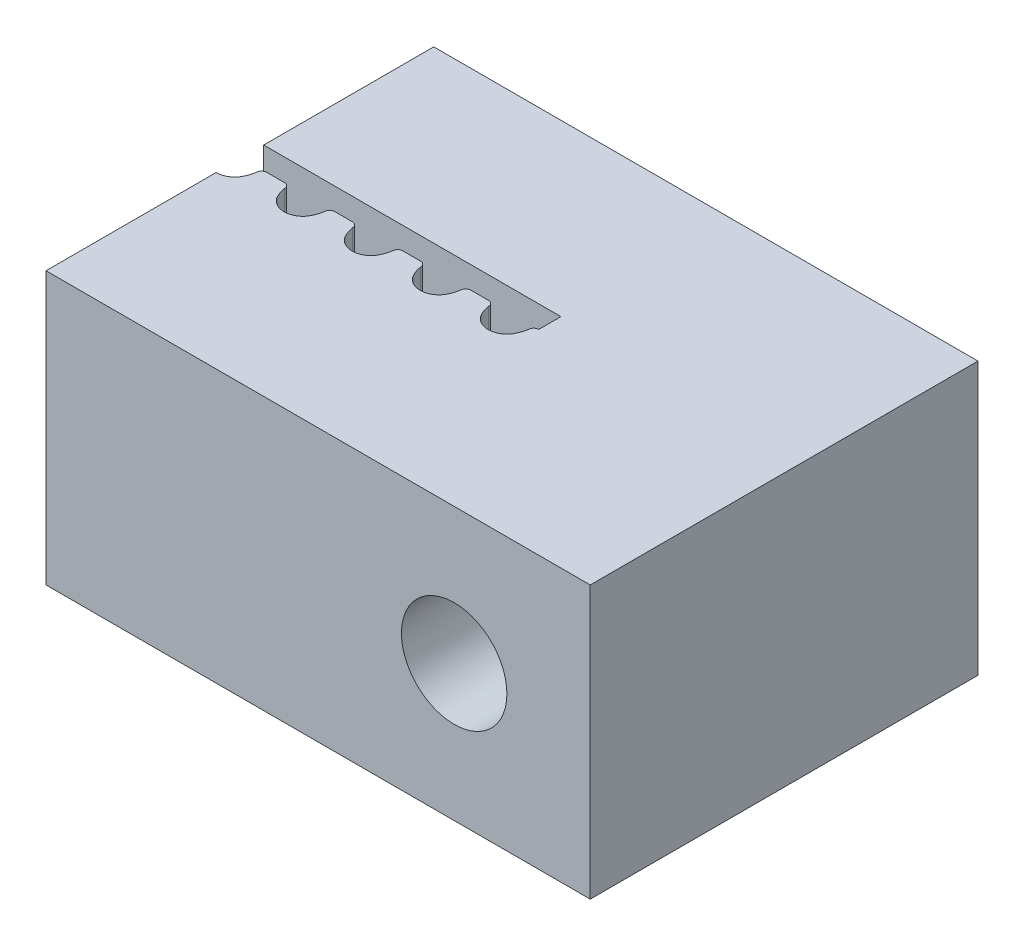
from build123d import *

# Parameters (mm, degrees)
BOSS_EXTRUDE1_DEPTH = 8
SKETCH3_W           = 7
SKETCH3_H           = 0.75
BOSS_EXTRUDE2_DEPTH = 8
BOSS_EXTRUDE3_DEPTH = 8
CUT_EXTRUDE1_REACH  = 21.747
SKETCH2_R           = 1.55


with BuildPart() as part:
    # Sketch1 → Boss-Extrude1 (new body)
    with BuildSketch(Plane(origin=(0, 0, 0), x_dir=(1, 0, 0), z_dir=(0, 1, 0))):
        with BuildLine():
            Line((-0.73791447, 0.195), (-1.26208553, 0.195))
            ThreePointArc((-1.26208553, 0.195), (-1.368151547, 0.151066017), (-1.41208553, 0.045))
            ThreePointArc((-1.41208553, 0.045), (-1.459490829, -0.139768303), (-1.541118048, -0.312173597))
            ThreePointArc((-1.541118048, -0.312173597), (-1.740415087, -0.490551397), (-2, -0.555))
            Line((-2, -0.555), (-2, -5.555))
            Line((-2, -5.555), (14, -5.555))
            Line((14, -5.555), (14, -0.555))
            ThreePointArc((14, -0.555), (13.740415087, -0.490551397), (13.541118048, -0.312173597))
            ThreePointArc((13.541118048, -0.312173597), (13.459490829, -0.139768303), (13.41208553, 0.045))
            ThreePointArc((13.41208553, 0.045), (13.368151547, 0.151066017), (13.26208553, 0.195))
            Line((13.26208553, 0.195), (12.73791447, 0.195))
            ThreePointArc((12.73791447, 0.195), (12.631848453, 0.151066017), (12.58791447, 0.045))
            ThreePointArc((12.58791447, 0.045), (12.540509171, -0.139768303), (12.458881952, -0.312173597))
            ThreePointArc((12.458881952, -0.312173597), (12.259584913, -0.490551397), (12, -0.555))
            ThreePointArc((12, -0.555), (11.740415087, -0.490551397), (11.541118048, -0.312173597))
            ThreePointArc((11.541118048, -0.312173597), (11.459490829, -0.139768303), (11.41208553, 0.045))
            ThreePointArc((11.41208553, 0.045), (11.368151547, 0.151066017), (11.26208553, 0.195))
            Line((11.26208553, 0.195), (10.73791447, 0.195))
            ThreePointArc((10.73791447, 0.195), (10.631848453, 0.151066017), (10.58791447, 0.045))
            ThreePointArc((10.58791447, 0.045), (10.540509171, -0.139768303), (10.458881952, -0.312173597))
            ThreePointArc((10.458881952, -0.312173597), (10.259584913, -0.490551397), (10, -0.555))
            ThreePointArc((10, -0.555), (9.740415087, -0.490551397), (9.541118048, -0.312173597))
            ThreePointArc((9.541118048, -0.312173597), (9.459490829, -0.139768303), (9.41208553, 0.045))
            ThreePointArc((9.41208553, 0.045), (9.368151547, 0.151066017), (9.26208553, 0.195))
            Line((9.26208553, 0.195), (8.73791447, 0.195))
            ThreePointArc((8.73791447, 0.195), (8.631848453, 0.151066017), (8.58791447, 0.045))
            ThreePointArc((8.58791447, 0.045), (8.540509171, -0.139768303), (8.458881952, -0.312173597))
            ThreePointArc((8.458881952, -0.312173597), (8.259584913, -0.490551397), (8, -0.555))
            ThreePointArc((8, -0.555), (7.740415087, -0.490551397), (7.541118048, -0.312173597))
            ThreePointArc((7.541118048, -0.312173597), (7.459490829, -0.139768303), (7.41208553, 0.045))
            ThreePointArc((7.41208553, 0.045), (7.368151547, 0.151066017), (7.26208553, 0.195))
            Line((7.26208553, 0.195), (6.73791447, 0.195))
            ThreePointArc((6.73791447, 0.195), (6.631848453, 0.151066017), (6.58791447, 0.045))
            ThreePointArc((6.58791447, 0.045), (6.540509171, -0.139768303), (6.458881952, -0.312173597))
            ThreePointArc((6.458881952, -0.312173597), (6.259584913, -0.490551397), (6, -0.555))
            ThreePointArc((6, -0.555), (5.740415087, -0.490551397), (5.541118048, -0.312173597))
            ThreePointArc((5.541118048, -0.312173597), (5.459490829, -0.139768303), (5.41208553, 0.045))
            ThreePointArc((5.41208553, 0.045), (5.368151547, 0.151066017), (5.26208553, 0.195))
            Line((5.26208553, 0.195), (4.73791447, 0.195))
            ThreePointArc((4.73791447, 0.195), (4.631848453, 0.151066017), (4.58791447, 0.045))
            ThreePointArc((4.58791447, 0.045), (4.540509171, -0.139768303), (4.458881952, -0.312173597))
            ThreePointArc((4.458881952, -0.312173597), (4.259584913, -0.490551397), (4, -0.555))
            ThreePointArc((4, -0.555), (3.740415087, -0.490551397), (3.541118048, -0.312173597))
            ThreePointArc((3.541118048, -0.312173597), (3.459490829, -0.139768303), (3.41208553, 0.045))
            ThreePointArc((3.41208553, 0.045), (3.368151547, 0.151066017), (3.26208553, 0.195))
            Line((3.26208553, 0.195), (2.73791447, 0.195))
            ThreePointArc((2.73791447, 0.195), (2.631848453, 0.151066017), (2.58791447, 0.045))
            ThreePointArc((2.58791447, 0.045), (2.540509171, -0.139768303), (2.458881952, -0.312173597))
            ThreePointArc((2.458881952, -0.312173597), (2.259584913, -0.490551397), (2, -0.555))
            ThreePointArc((2, -0.555), (1.740415087, -0.490551397), (1.541118048, -0.312173597))
            ThreePointArc((1.541118048, -0.312173597), (1.459490829, -0.139768303), (1.41208553, 0.045))
            ThreePointArc((1.41208553, 0.045), (1.368151547, 0.151066017), (1.26208553, 0.195))
            Line((1.26208553, 0.195), (0.73791447, 0.195))
            ThreePointArc((0.73791447, 0.195), (0.631848453, 0.151066017), (0.58791447, 0.045))
            ThreePointArc((0.58791447, 0.045), (0.540509171, -0.139768303), (0.458881952, -0.312173597))
            ThreePointArc((0.458881952, -0.312173597), (0.259584913, -0.490551397), (0, -0.555))
            ThreePointArc((0, -0.555), (-0.259584913, -0.490551397), (-0.458881952, -0.312173597))
            ThreePointArc((-0.458881952, -0.312173597), (-0.540509171, -0.139768303), (-0.58791447, 0.045))
            ThreePointArc((-0.58791447, 0.045), (-0.631848453, 0.151066017), (-0.73791447, 0.195))
        make_face()
    extrude(amount=BOSS_EXTRUDE1_DEPTH)

    # Sketch3 → Boss-Extrude2 (add)
    with BuildSketch(Plane(origin=(0, 8, 0), x_dir=(1, 0, 0), z_dir=(0, 1, 0))):
        with Locations((10.5, -0.18)):
            Rectangle(SKETCH3_W, SKETCH3_H)
    extrude(amount=-BOSS_EXTRUDE2_DEPTH)

    # Sketch4 → Boss-Extrude3 (add)
    with BuildSketch(Plane(origin=(0, 8, 0), x_dir=(1, 0, 0), z_dir=(0, 1, 0))):
        Polygon((6.73791447, 0.195), (6.73791447, 0.845), (-2, 0.845), (-2, 5.845), (14, 5.845), (14, 0.195), align=None)
    extrude(amount=-BOSS_EXTRUDE3_DEPTH)

    # Sketch2 → Cut-Extrude1 (cut, up to next)
    with BuildSketch(Plane.XY.offset(5.555), mode=Mode.PRIVATE) as cut_extrude1_sk1:
        with Locations((10, 4)):
            Circle(SKETCH2_R)
    cut_extrude1_tool1 = extrude(cut_extrude1_sk1.sketch, amount=-CUT_EXTRUDE1_REACH, mode=Mode.PRIVATE) & part.part
    add(cut_extrude1_tool1.solids().sort_by_distance((10, 4, 5.555))[0], mode=Mode.SUBTRACT)


solid = part.part
